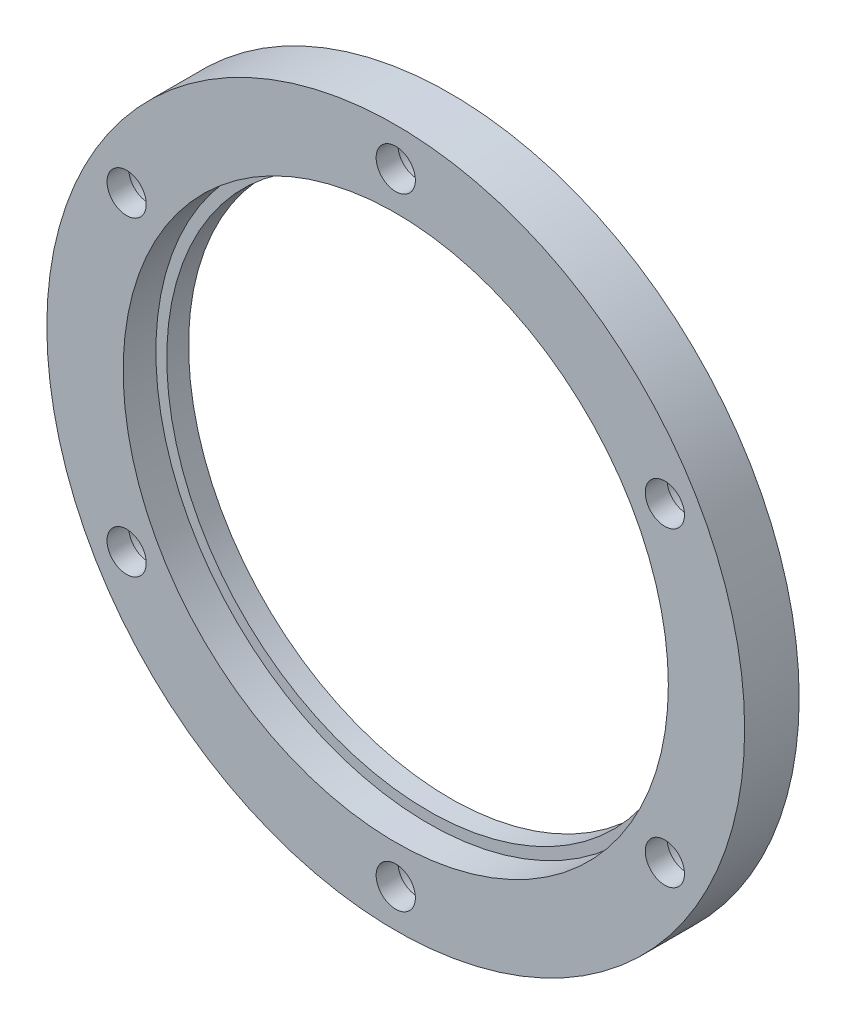
from build123d import *

# Parameters (mm, degrees)
SKETCH_1_R          = 32
SKETCH_1_R_2        = 24
EXTRUDE_1_DEPTH     = 2
SKETCH_2_R          = 32
SKETCH_2_R_2        = 25
EXTRUDE_2_DEPTH     = 4
SKETCH_3_R          = 1.8
CUT_EXTRUDE_1_DEPTH = 46.650848842
SKETCH_4_R          = 2.85
CUT_EXTRUDE_2_DEPTH = 3
SKETCH_5_R          = 32
SKETCH_5_R_2        = 25
SKETCH_5_R_3        = 1.8
CUT_EXTRUDE_3_DEPTH = 1


with BuildPart() as part:
    # 草图1 → 凸台-拉伸1 (new body)
    with BuildSketch(Plane.XY):
        Circle(SKETCH_1_R)
        Circle(SKETCH_1_R_2, mode=Mode.SUBTRACT)
    extrude(amount=EXTRUDE_1_DEPTH)

    # 草图2 → 凸台-拉伸2 (add)
    with BuildSketch(Plane.XY.offset(2)):
        Circle(SKETCH_2_R)
        Circle(SKETCH_2_R_2, mode=Mode.SUBTRACT)
    extrude(amount=EXTRUDE_2_DEPTH)

    # 草图3 → 切除-拉伸1 (cut, through all)
    with BuildSketch(Plane.XY.offset(6)):
        with Locations((0, 28.5)):
            Circle(SKETCH_3_R)
        with Locations((24.681724008, 14.25)):
            Circle(SKETCH_3_R)
        with Locations((24.681724008, -14.25)):
            Circle(SKETCH_3_R)
        with Locations((0, -28.5)):
            Circle(SKETCH_3_R)
        with Locations((-24.681724008, -14.25)):
            Circle(SKETCH_3_R)
        with Locations((-24.681724008, 14.25)):
            Circle(SKETCH_3_R)
    extrude(amount=-CUT_EXTRUDE_1_DEPTH, mode=Mode.SUBTRACT)

    # 草图4 → 切除-拉伸2 (cut)
    with BuildSketch(Plane(origin=(0, 0, 0), x_dir=(-1, 0, 0), z_dir=(0, 0, -1))):
        with Locations((-24.681724008, -14.25)):
            Circle(SKETCH_4_R)
        with Locations((-24.681724008, 14.25)):
            Circle(SKETCH_4_R)
        with Locations((0, 28.5)):
            Circle(SKETCH_4_R)
        with Locations((24.681724008, 14.25)):
            Circle(SKETCH_4_R)
        with Locations((24.681724008, -14.25)):
            Circle(SKETCH_4_R)
        with Locations((0, -28.5)):
            Circle(SKETCH_4_R)
    extrude(amount=-CUT_EXTRUDE_2_DEPTH, mode=Mode.SUBTRACT)

    # 草图5 → 切除-拉伸3 (cut)
    with BuildSketch(Plane.XY.offset(6)):
        Circle(SKETCH_5_R)
        Circle(SKETCH_5_R_2, mode=Mode.SUBTRACT)
        with Locations((-24.681724008, 14.25)):
            Circle(SKETCH_5_R_3, mode=Mode.SUBTRACT)
        with Locations((0, 28.5)):
            Circle(SKETCH_5_R_3, mode=Mode.SUBTRACT)
        with Locations((24.681724008, 14.25)):
            Circle(SKETCH_5_R_3, mode=Mode.SUBTRACT)
        with Locations((24.681724008, -14.25)):
            Circle(SKETCH_5_R_3, mode=Mode.SUBTRACT)
        with Locations((0, -28.5)):
            Circle(SKETCH_5_R_3, mode=Mode.SUBTRACT)
        with Locations((-24.681724008, -14.25)):
            Circle(SKETCH_5_R_3, mode=Mode.SUBTRACT)
    extrude(amount=-CUT_EXTRUDE_3_DEPTH, mode=Mode.SUBTRACT)


solid = part.part
